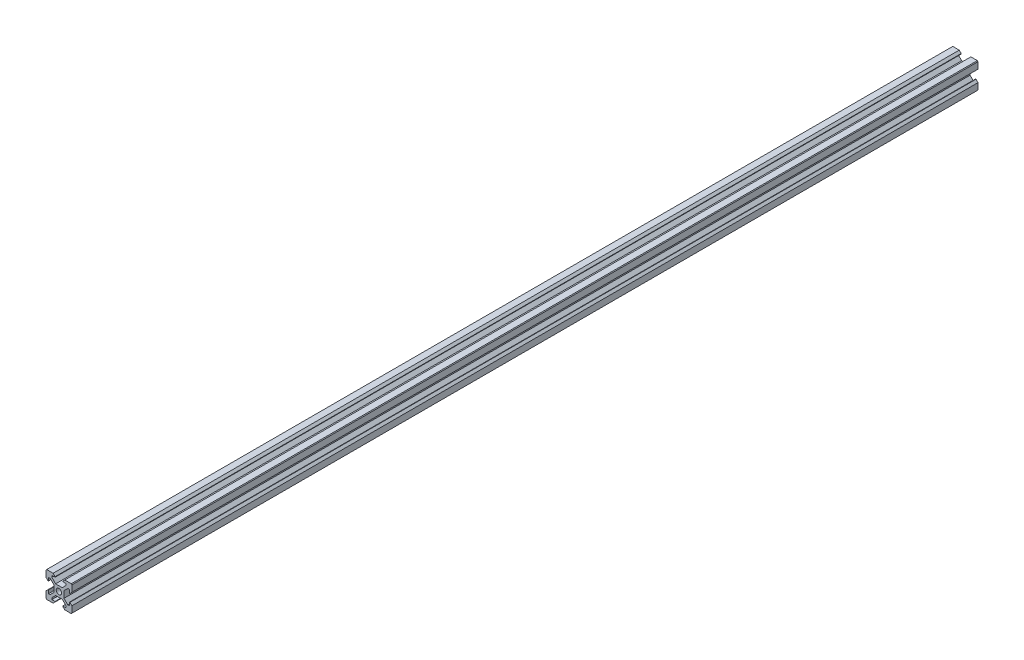
from build123d import *

# Parameters (mm, degrees)
BOSS_EXTRUDE1_DEPTH = 700
CHAMFER2_SIZE       = 0.5
CHAMFER2_SIZE2      = 0.353553391
CHAMFER1_SIZE       = 0.5


with BuildPart() as part:
    # Sketch1 → Boss-Extrude1 (new body)
    with BuildSketch(Plane.XY):
        with BuildLine():
            Line((5.5, 6.829360749), (2.570639251, 3.9))
            Line((2.570639251, 3.9), (0, 3.9))
            Line((0, 3.9), (0, 2.1))
            ThreePointArc((0, 2.1), (0.803635208, 1.940147018), (1.48492424, 1.48492424))
            Line((1.48492424, 1.48492424), (10, 10))
            Line((10, 10), (4.5, 10))
            Line((4.5, 10), (2.62, 8.12))
            Line((2.62, 8.12), (5.5, 8.12))
            Line((5.5, 8.12), (5.5, 6.829360749))
        make_face()
    extrude(amount=BOSS_EXTRUDE1_DEPTH)

    # Chamfer2
    chamfer2_edges = [part.edges().sort_by_distance(p)[0] for p in [
        (2.62, 8.12, 350),
    ]]
    chamfer2_side = [part.faces().sort_by_distance(p)[0] for p in [
        (3.56, 9.06, 350),
    ]]
    chamfer(chamfer2_edges, length=CHAMFER2_SIZE, length2=CHAMFER2_SIZE2, reference=chamfer2_side[0])

    # Mirror1: part across plane


with BuildPart() as part_1:
    add(part.part)
    add(part.part.mirror(Plane(origin=(10, 10, 700), x_dir=(0, 0, 1), z_dir=(-0.707106781186544, 0.707106781186551, 0))))

    # Chamfer1
    chamfer1_edges = [part_1.edges().sort_by_distance(p)[0] for p in [
        (10, 10, 350),
    ]]
    chamfer(chamfer1_edges, length=CHAMFER1_SIZE)

    # Mirror4: part across plane


with BuildPart() as part_2:
    add(part_1.part)
    add(part_1.part.mirror(Plane(origin=(0, 3.9, 700), x_dir=(0, 0, 1), z_dir=(1, 0, 0))))

    # Mirror5: part across plane


with BuildPart() as part_3:
    add(part_2.part)
    add(part_2.part.mirror(Plane(origin=(-3.9, 0, 700), x_dir=(0, 0, 1), z_dir=(0, 1, 0))))


solid = part_3.part
